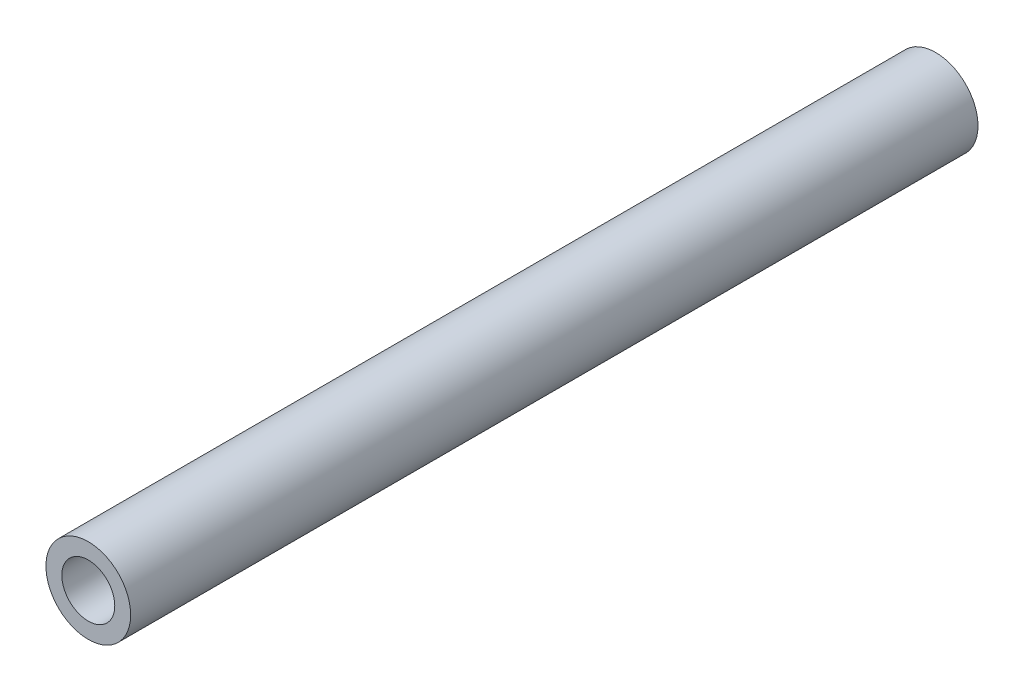
from build123d import *

# Parameters (mm, degrees)
SKETCH_1_R      = 4
SKETCH_1_R_2    = 2.5
EXTRUDE_1_DEPTH = 80


with BuildPart() as part:
    # 草图1 → 凸台-拉伸1 (new body)
    with BuildSketch(Plane.XY):
        Circle(SKETCH_1_R)
        Circle(SKETCH_1_R_2, mode=Mode.SUBTRACT)
    extrude(amount=EXTRUDE_1_DEPTH)


solid = part.part
